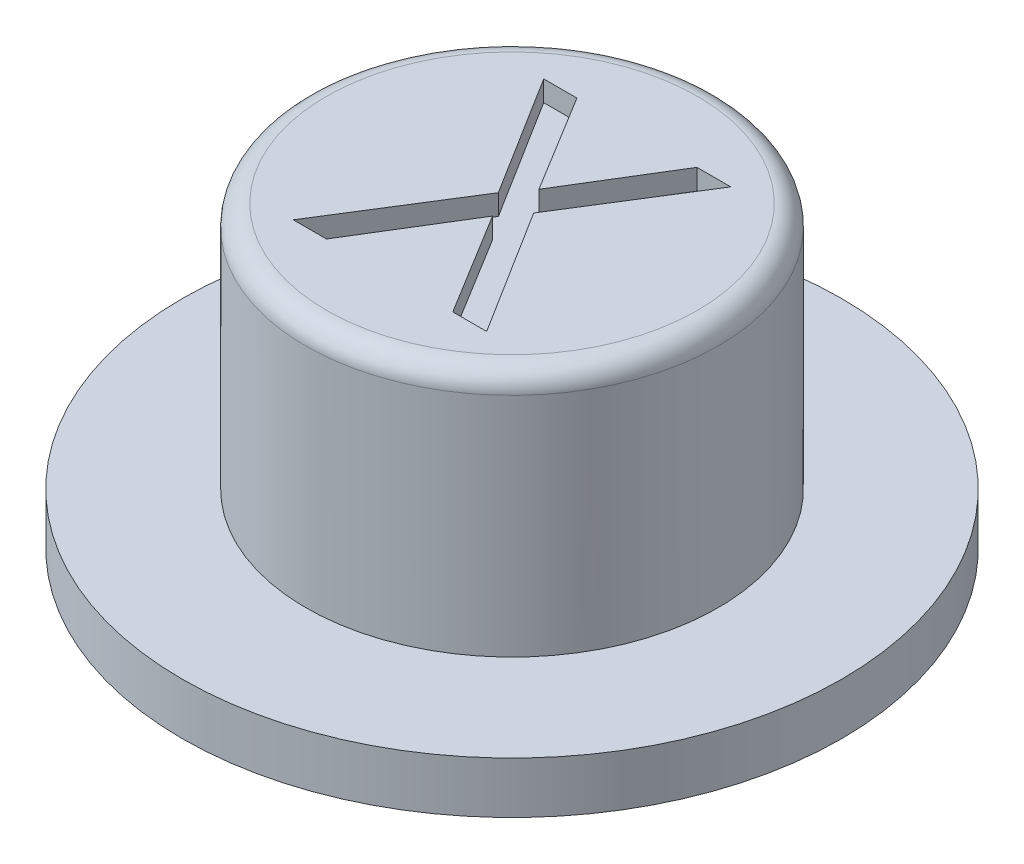
from build123d import *

# Parameters (mm, degrees)
SKETCH2_W          = 2.5
SKETCH2_H          = 3.5
CUT_EXTRUDE1_DEPTH = 3.5
FILLET1_R          = 0.5
CUT_EXTRUDE2_DEPTH = 0.5


with BuildPart() as part:
    # Sketch1 → Revolve1 (revolve)
    with BuildSketch(Plane.XY, mode=Mode.PRIVATE) as revolve1_sk:
        Polygon((0, 7.25), (5, 7.25), (5, 1.25), (8, 1.25), (8, 0), (0, 0), align=None)
    revolve(revolve1_sk.sketch.rotate(Axis((0, 7.25, 0), (0, -1, 0)), 180), axis=Axis((0, 7.25, 0), (0, -1, 0)))

    # Sketch2 → Cut-Extrude1 (cut)
    with BuildSketch(Plane.XZ):
        Rectangle(SKETCH2_W, SKETCH2_H)
    extrude(amount=-CUT_EXTRUDE1_DEPTH, mode=Mode.SUBTRACT)

    # Fillet1
    fillet1_edges = [part.edges().sort_by_distance(p)[0] for p in [
        (5, 7.25, 0),
    ]]
    fillet(fillet1_edges, radius=FILLET1_R)

    # Sketch3 → Cut-Extrude2 (cut)
    with BuildSketch(Plane(origin=(0, 7.25, 0), x_dir=(1, 0, 0), z_dir=(0, 1, 0))):
        Polygon((-2.230769231, 3), (-1.424278846, 3), (0.03125, 0.622596154), (1.486778846, 3), (2.307692308, 3), (0.466346154, 0.060096154), (2.384615385, -3), (1.563701923, -3), (0.03125, -0.503605769), (-1.501201923, -3), (-2.307692308, -3), (-0.389423077, 0.058894231), align=None)
    extrude(amount=-CUT_EXTRUDE2_DEPTH, mode=Mode.SUBTRACT)


solid = part.part
